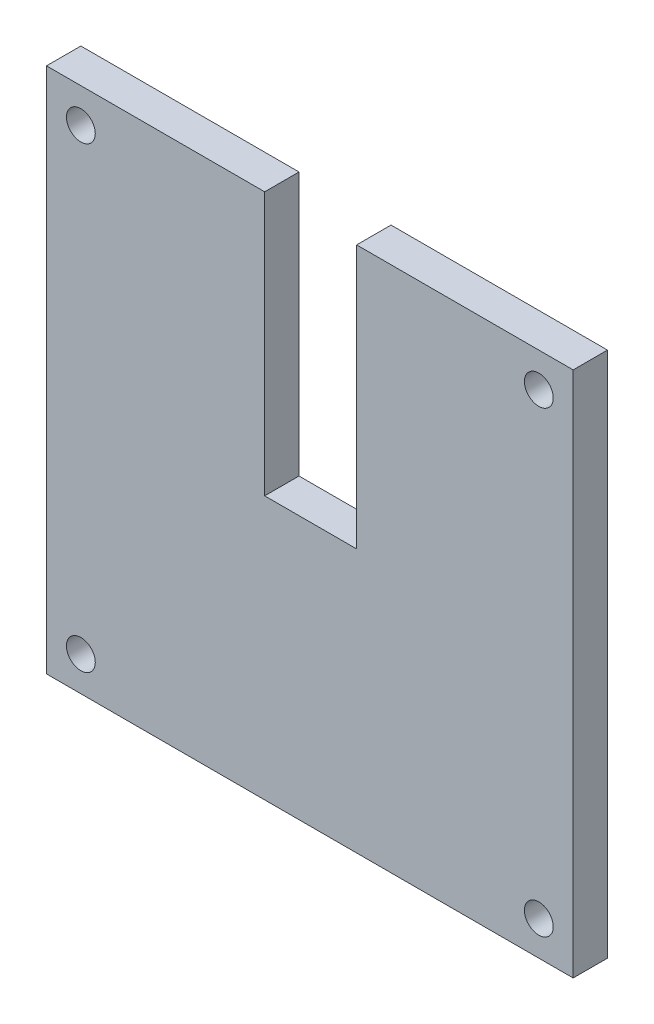
from build123d import *

# Parameters (mm, degrees)
SKETCH1_W           = 58.42
SKETCH1_H           = 58.42
BOSS_EXTRUDE1_DEPTH = 3.81
SKETCH2_R           = 1.5999968
SKETCH2_R_2         = 1.6
CUT_EXTRUDE1_DEPTH  = 3.81
SKETCH5_W           = 10.202183674
SKETCH5_H           = 29.21
CUT_EXTRUDE3_DEPTH  = 3.81


with BuildPart() as part:
    # Sketch1 → Boss-Extrude1 (new body)
    with BuildSketch(Plane.XY):
        Rectangle(SKETCH1_W, SKETCH1_H)
    extrude(amount=BOSS_EXTRUDE1_DEPTH)

    # Sketch2 → Cut-Extrude1 (cut)
    with BuildSketch(Plane.XY.offset(3.81)):
        with Locations((-25.400000617, 25.400000617)):
            Circle(SKETCH2_R)
        with Locations((25.400000617, 25.400000617)):
            Circle(SKETCH2_R_2)
        with Locations((-25.400000617, -25.400000617)):
            Circle(SKETCH2_R_2)
        with Locations((25.400000617, -25.400000617)):
            Circle(SKETCH2_R_2)
    extrude(amount=-CUT_EXTRUDE1_DEPTH, mode=Mode.SUBTRACT)

    # Sketch5 → Cut-Extrude3 (cut)
    with BuildSketch(Plane.XY.offset(3.81)):
        with Locations((0.091911565, 14.605)):
            Rectangle(SKETCH5_W, SKETCH5_H)
    extrude(amount=-CUT_EXTRUDE3_DEPTH, mode=Mode.SUBTRACT)


solid = part.part
